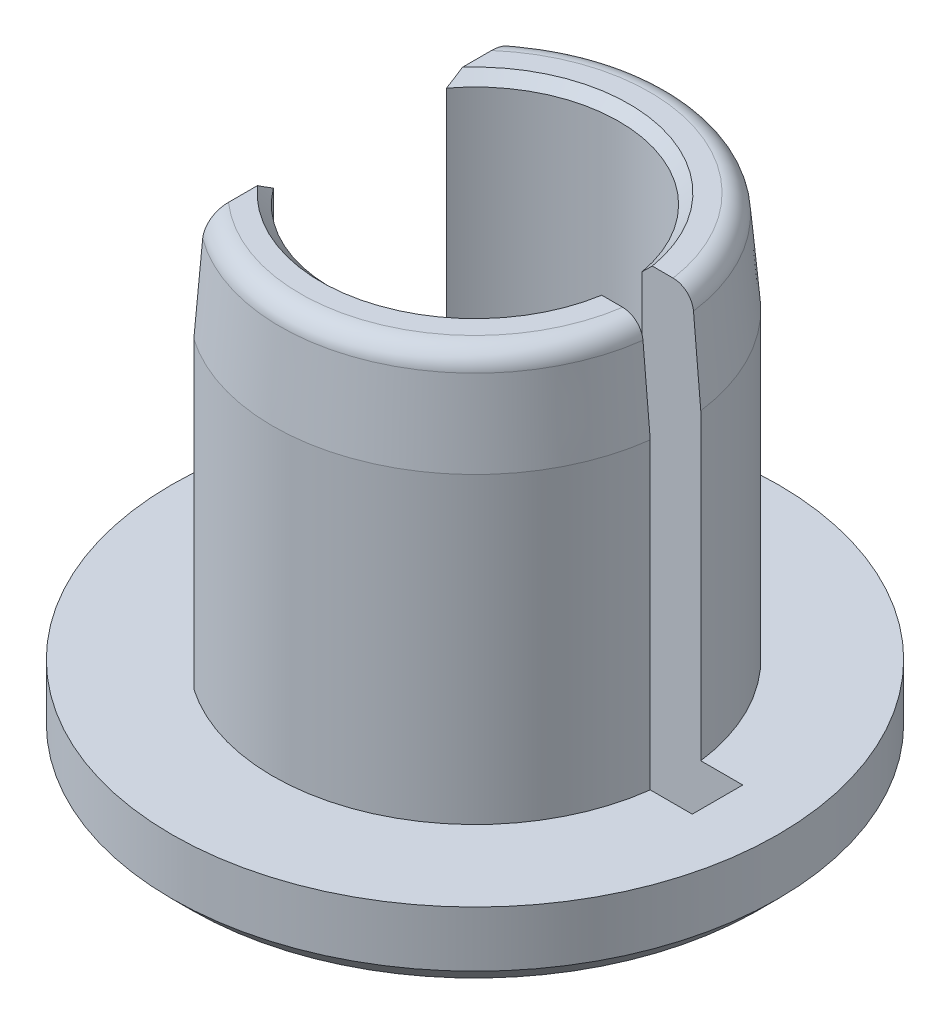
from build123d import *

# Parameters (mm, degrees)
SKETCH2_R             = 3
BOSS_EXTRUDE2_DEPTH   = 0.75
BOSS_EXTRUDE3_DEPTH   = 4
CROQUIS1_R            = 1.425
CORTAR_EXTRUIR1_DEPTH = 7.368869601
CHAFL_N1_SIZE         = 0.2
CHAFL_N2_SIZE         = 1
CHAFL_N2_SIZE2        = 0.087488664
CHAFL_N3_SIZE         = 0.1
REDONDEO1_R           = 0.2
CROQUIS2_W            = 1.845726181
CROQUIS2_H            = 0.5
CORTAR_EXTRUIR2_DEPTH = 7.368869676


with BuildPart() as part:
    # Sketch2 → Boss-Extrude2 (new body)
    with BuildSketch(Plane(origin=(0, 0, 0), x_dir=(-1, 0, 0), z_dir=(0, 1, 0))):
        with Locations(Location((0, 0, 0), (0, 0, 90))):
            Circle(SKETCH2_R)
    extrude(amount=BOSS_EXTRUDE2_DEPTH)

    # Sketch3 → Boss-Extrude3 (add)
    with BuildSketch(Plane(origin=(0, 0.75, 0), x_dir=(-1, 0, 0), z_dir=(0, 1, 0))):
        with BuildLine():
            Line((1.13862177, 1.644244649), (1.13862177, -1.644244649))
            ThreePointArc((1.13862177, -1.644244649), (-2, 0), (1.13862177, 1.644244649))
        make_face()
    extrude(amount=BOSS_EXTRUDE3_DEPTH)

    # Croquis1 → Cortar-Extruir1 (cut, through all)
    with BuildSketch(Plane(origin=(0, 4.75, 0), x_dir=(1, 0, 0), z_dir=(0, 1, 0))):
        with Locations(Location((0, 0, 0), (0, 0, 270))):
            Circle(CROQUIS1_R)
    extrude(amount=-CORTAR_EXTRUIR1_DEPTH, mode=Mode.SUBTRACT)

    # Chaflán1
    chafl_n1_edges = [part.edges().sort_by_distance(p)[0] for p in [
        (0, 0, -3),
    ]]
    chamfer(chafl_n1_edges, length=CHAFL_N1_SIZE)

    # Chaflán2
    chafl_n2_edges = [part.edges().sort_by_distance(p)[0] for p in [
        (2, 4.75, 0),
    ]]
    chafl_n2_side = [part.faces().sort_by_distance(p)[0] for p in [
        (2, 2.75, 0),
    ]]
    chamfer(chafl_n2_edges, length=CHAFL_N2_SIZE, length2=CHAFL_N2_SIZE2, reference=chafl_n2_side[0])

    # Chaflán3
    chafl_n3_edges = [part.edges().sort_by_distance(p)[0] for p in [
        (1.275071419, 4.75, -0.636252996),
    ]]
    chamfer(chafl_n3_edges, length=CHAFL_N3_SIZE)

    # Redondeo1
    redondeo1_edges = [part.edges().sort_by_distance(p)[0] for p in [
        (1.912511336, 4.75, 0),
    ]]
    fillet(redondeo1_edges, radius=REDONDEO1_R)

    # Croquis2 → Cortar-Extruir2 (cut, through all)
    with BuildSketch(Plane.XZ):
        with Locations((1.47713691, 0)):
            Rectangle(CROQUIS2_W, CROQUIS2_H)
    cortar_extruir2 = extrude(amount=-CORTAR_EXTRUIR2_DEPTH, mode=Mode.SUBTRACT)

    # Simetría1: Cortar-Extruir2 across plane
    add(cortar_extruir2.mirror(Plane(origin=(0, 0, 0), x_dir=(0, 0, 1), z_dir=(1, 0, 0))), mode=Mode.SUBTRACT)


solid = part.part
